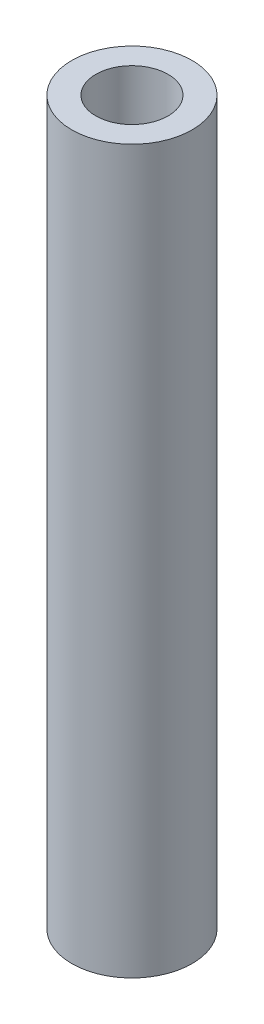
from build123d import *

# Parameters (mm, degrees)
SKIZZE1_R                       = 2.5
SKIZZE1_R_2                     = 1.5
AUFSATZ_LINEAR_AUSTRAGEN1_DEPTH = 30


with BuildPart() as part:
    # Skizze1 → Aufsatz-Linear austragen1 (new body)
    with BuildSketch(Plane(origin=(0, 0, 0), x_dir=(1, 0, 0), z_dir=(0, 1, 0))):
        with Locations(Location((0, 0, 0), (0, 0, 270))):
            Circle(SKIZZE1_R)
        with Locations(Location((0, 0, 0), (0, 0, 270))):
            Circle(SKIZZE1_R_2, mode=Mode.SUBTRACT)
    extrude(amount=AUFSATZ_LINEAR_AUSTRAGEN1_DEPTH)


solid = part.part
